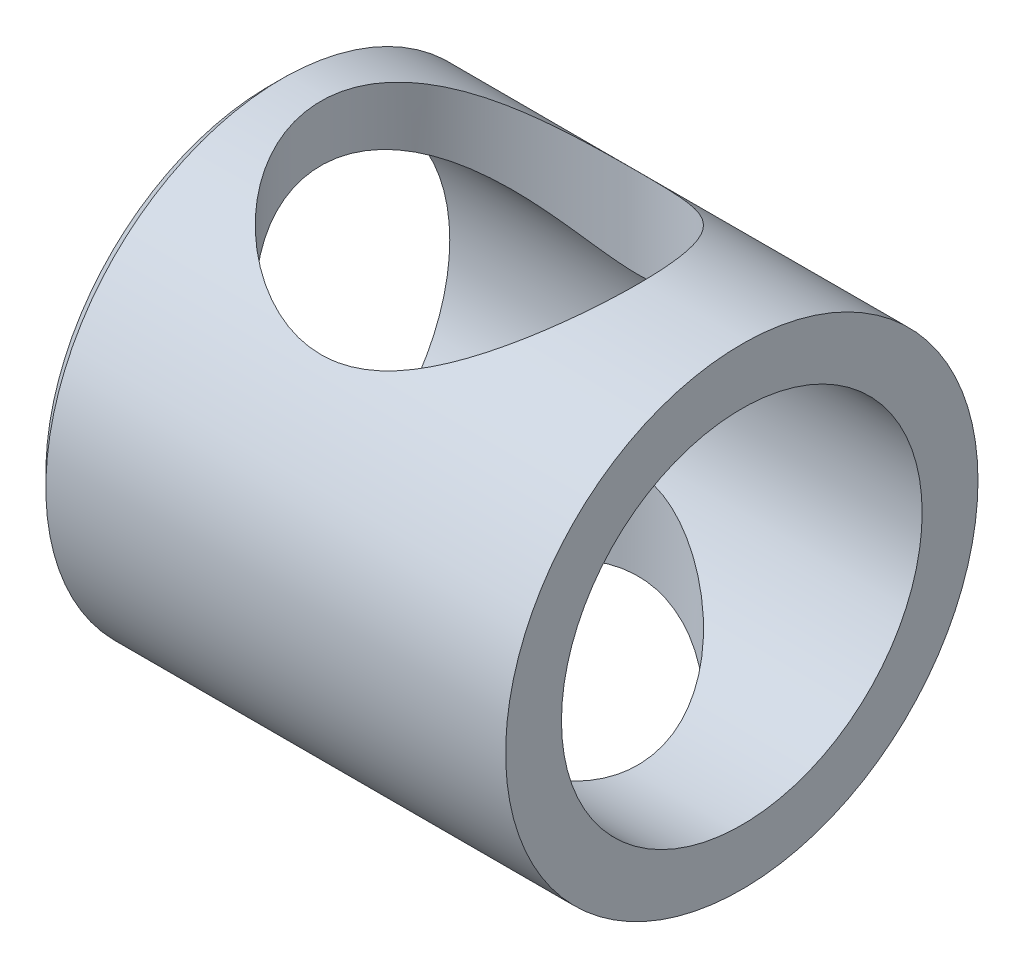
from build123d import *

# Parameters (mm, degrees)
SKETCH1_R           = 14.2875
SKETCH1_R_2         = 10.9093
BOSS_EXTRUDE1_DEPTH = 28.575
SKETCH2_R           = 9.5885
CUT_EXTRUDE1_DEPTH  = 19.05
CHAMFER1_SIZE       = 0.762


with BuildPart() as part:
    # Sketch1 → Boss-Extrude1 (new body)
    with BuildSketch(Plane(origin=(0, 0, 0), x_dir=(0, 0, -1), z_dir=(1, 0, 0))):
        Circle(SKETCH1_R)
        Circle(SKETCH1_R_2, mode=Mode.SUBTRACT)
    extrude(amount=BOSS_EXTRUDE1_DEPTH)

    # Sketch2 → Cut-Extrude1 (cut, symmetric)
    with BuildSketch(Plane(origin=(0, 0, 0), x_dir=(1, 0, 0), z_dir=(0, 1, 0))):
        with Locations(Location((12.7, 0, 0), (0, 0, 270))):
            Circle(SKETCH2_R)
    extrude(amount=CUT_EXTRUDE1_DEPTH, both=True, mode=Mode.SUBTRACT)

    # Chamfer1
    chamfer1_edges = [part.edges().sort_by_distance(p)[0] for p in [
        (0, 0, 14.2875),
    ]]
    chamfer(chamfer1_edges, length=CHAMFER1_SIZE)


solid = part.part
